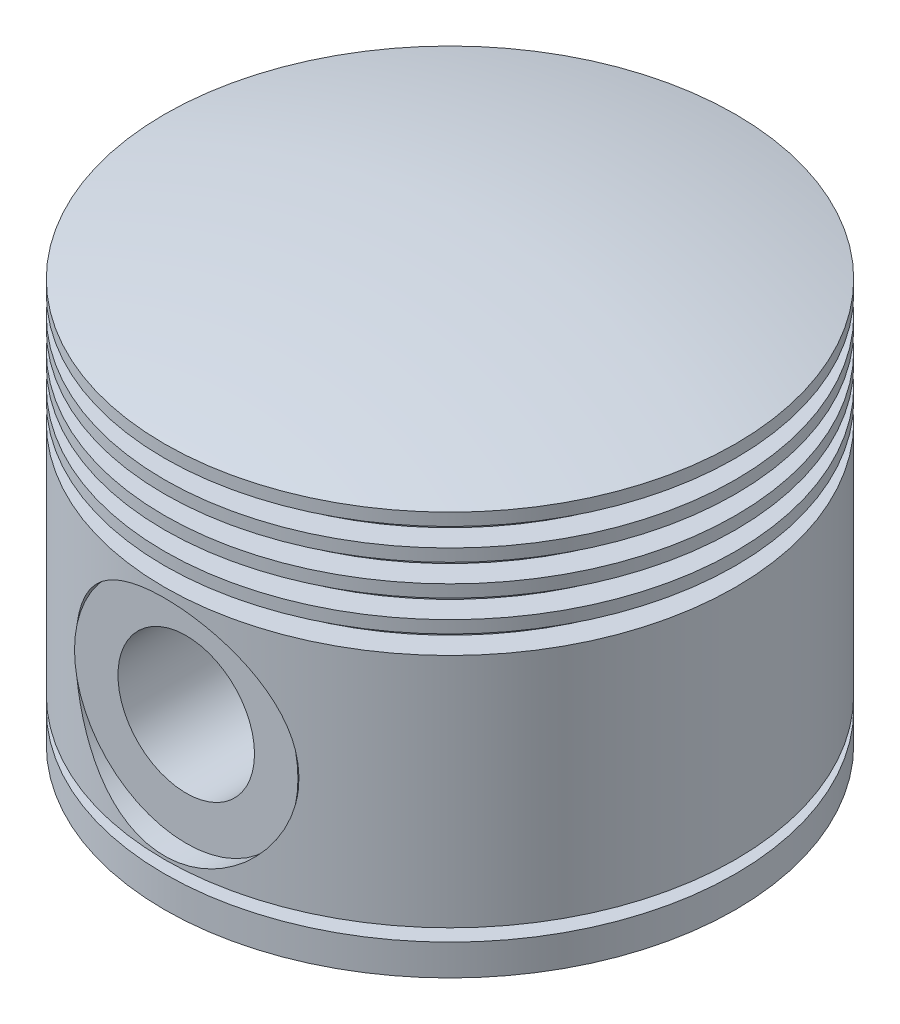
from build123d import *

# Parameters (mm, degrees)
SKETCH7_W           = 18
SKETCH7_H           = 46
SKETCH8_R           = 18
SKETCH8_R_2         = 11
BOSS_EXTRUDE1_DEPTH = 17.5


with BuildPart() as part:
    # Sketch1 → Revolve1 (revolve)
    with BuildSketch(Plane.XY, mode=Mode.PRIVATE) as revolve1_sk:
        with BuildLine():
            Line((37, 0), (46, 0))
            Line((46, 0), (46, 5))
            Line((46, 5), (42, 5))
            Line((42, 5), (42, 7))
            Line((42, 7), (46, 7))
            Line((46, 7), (46, 45))
            Line((46, 45), (42, 45))
            Line((42, 45), (42, 48))
            Line((42, 48), (46, 48))
            Line((46, 48), (46, 50))
            Line((46, 50), (42, 50))
            Line((42, 50), (42, 53))
            Line((42, 53), (46, 53))
            Line((46, 53), (46, 55))
            Line((46, 55), (42, 55))
            Line((42, 55), (42, 58))
            Line((42, 58), (46, 58))
            Line((46, 58), (46, 60))
            Line((46, 60), (42, 60))
            Line((42, 60), (42, 63))
            Line((42, 63), (46, 63))
            Line((46, 63), (46, 65))
            ThreePointArc((46, 65), (23.180726365, 69.327783179), (0, 70.777914783))
            Line((0, 70.777914783), (0, 62))
            Line((0, 62), (37, 62))
            Line((37, 62), (37, 0))
        make_face()
    revolve(revolve1_sk.sketch.rotate(Axis((0, 70.777914783, 0), (0, -1, 0)), 180), axis=Axis((0, 70.777914783, 0), (0, -1, 0)))

    # Sketch7 → Ø12.0mm Dowel Hole3 (revolve, cut)
    with BuildSketch(Plane(origin=(0, 25.5, 0), x_dir=(0, 1, 0), z_dir=(1, 0, 0))):
        with Locations((9, 23)):
            Rectangle(SKETCH7_W, SKETCH7_H)
    f_12_0mm_dowel_hole3 = revolve(axis=Axis((0, 25.5, -6.35), (0, 0, 1)), mode=Mode.SUBTRACT)

    # Sketch8 → Boss-Extrude1 (add)
    with BuildSketch(Plane.XY.offset(25)):
        with Locations(Location((0, 25.5, 0), (0, 0, 180))):
            Circle(SKETCH8_R)
        with Locations((0, 25.5)):
            Circle(SKETCH8_R_2, mode=Mode.SUBTRACT)
    boss_extrude1 = extrude(amount=BOSS_EXTRUDE1_DEPTH)

    # Mirror1: Ø12.0mm Dowel Hole3, Boss-Extrude1 across plane
    add(f_12_0mm_dowel_hole3.mirror(Plane.XY), mode=Mode.SUBTRACT)
    add(boss_extrude1.mirror(Plane.XY))


solid = part.part
